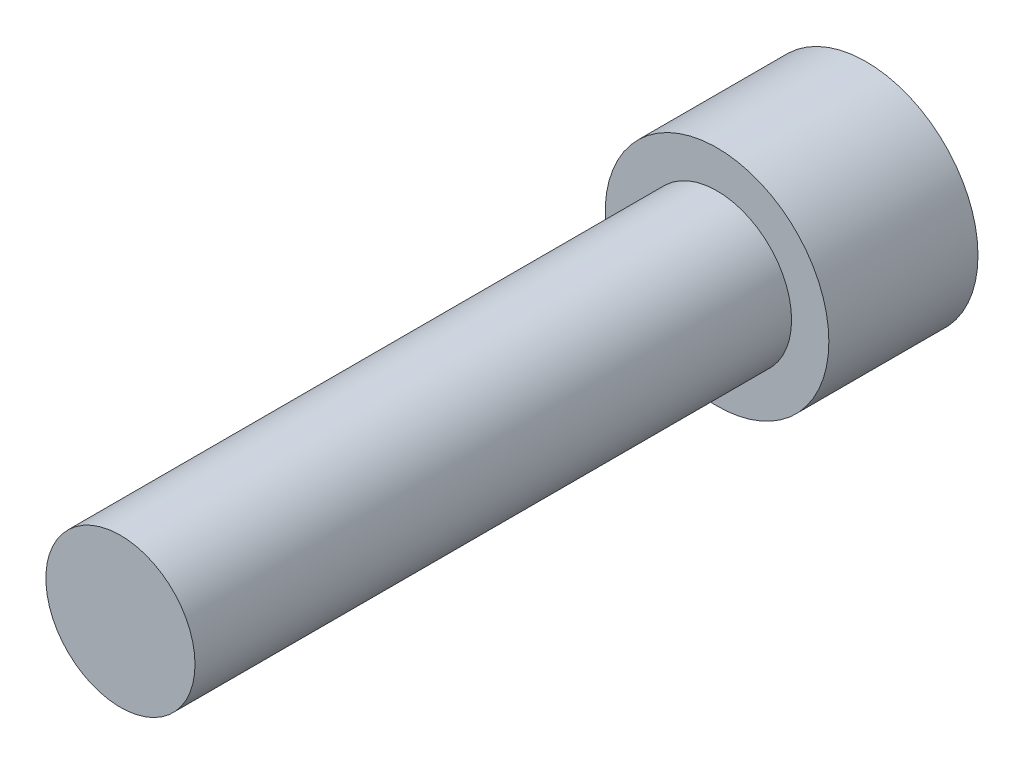
from build123d import *

# Parameters (mm, degrees)
SKETCH2_R           = 7.5
BOSS_EXTRUDE3_DEPTH = 10
SKETCH4_R           = 5
BOSS_EXTRUDE4_DEPTH = 40
CUT_EXTRUDE1_DEPTH  = 7


with BuildPart() as part:
    # Sketch2 → Boss-Extrude3 (new body)
    with BuildSketch(Plane.XY):
        Circle(SKETCH2_R)
    extrude(amount=BOSS_EXTRUDE3_DEPTH)

    # Sketch4 → Boss-Extrude4 (add)
    with BuildSketch(Plane.XY.offset(10)):
        Circle(SKETCH4_R)
    extrude(amount=BOSS_EXTRUDE4_DEPTH)

    # Sketch3 → Cut-Extrude1 (cut)
    with BuildSketch(Plane(origin=(0, 0, 0), x_dir=(-1, 0, 0), z_dir=(0, 0, -1))):
        Polygon((2.886751346, 5), (-2.886751346, 5), (-5.773502692, 0), (-2.886751346, -5), (2.886751346, -5), (5.773502692, 0), align=None)
    extrude(amount=-CUT_EXTRUDE1_DEPTH, mode=Mode.SUBTRACT)


solid = part.part
